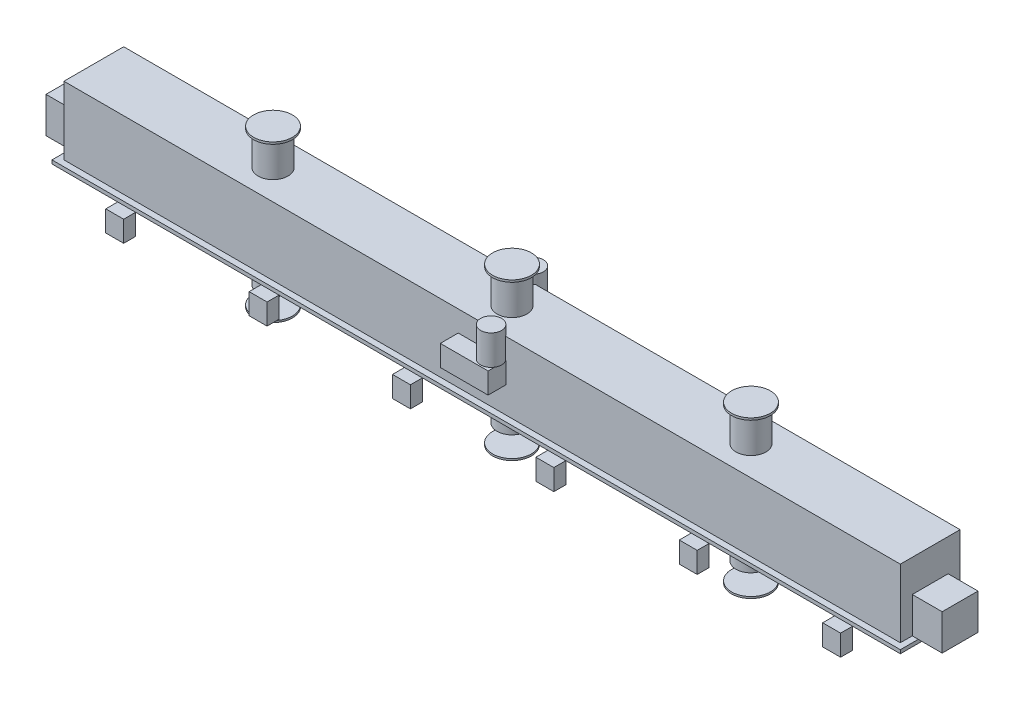
from build123d import *

# Parameters (mm, degrees)
SKETCH1_W               = 14000
SKETCH1_H               = 1000
BOSS_EXTRUDE1_DEPTH     = 500
BOSS_EXTRUDE2_START     = -500
SKETCH2_R               = 250
BOSS_EXTRUDE2_DEPTH     = 350
BOSS_EXTRUDE2_2_DEPTH   = 350
BOSS_EXTRUDE2_3_DEPTH   = 350
BOSS_EXTRUDE3_START     = -820
SKETCH3_R               = 325
BOSS_EXTRUDE3_DEPTH     = 30
BOSS_EXTRUDE3_2_DEPTH   = 30
BOSS_EXTRUDE3_3_DEPTH   = 30
SKETCH4_W               = 14200
SKETCH4_H               = 1200
BOSS_EXTRUDE4_DEPTH     = 60
BOSS_EXTRUDE5_START     = 60
SKETCH5_W               = 14000
SKETCH5_H               = 1000
BOSS_EXTRUDE5_DEPTH     = 1140
BOSS_EXTRUDE6_START     = 1200
SKETCH6_R               = 250
BOSS_EXTRUDE6_DEPTH     = 600
BOSS_EXTRUDE7_START     = 1765
SKETCH7_R               = 325
BOSS_EXTRUDE7_DEPTH     = 35
BOSS_EXTRUDE8_START     = 60
SKETCH8_W               = 500
SKETCH8_H               = 600
BOSS_EXTRUDE8_DEPTH     = 600
BOSS_EXTRUDE9_START     = 500
SKETCH9_W               = 800
SKETCH9_H               = 1600
BOSS_EXTRUDE9_DEPTH     = 350
BOSS_EXTRUDE10_START    = 850
SKETCH10_R              = 175
BOSS_EXTRUDE10_DEPTH    = 500
BOSS_EXTRUDE11_START    = -500
SKETCH11_W              = 300
SKETCH11_H              = 200
BOSS_EXTRUDE11_DEPTH    = 350
BOSS_EXTRUDE11_2_DEPTH  = 350
BOSS_EXTRUDE11_3_DEPTH  = 350
BOSS_EXTRUDE11_4_DEPTH  = 350
BOSS_EXTRUDE11_5_DEPTH  = 350
BOSS_EXTRUDE11_6_DEPTH  = 350
BOSS_EXTRUDE11_7_DEPTH  = 350
BOSS_EXTRUDE11_8_DEPTH  = 350
BOSS_EXTRUDE11_9_DEPTH  = 350
BOSS_EXTRUDE11_10_DEPTH = 350
BOSS_EXTRUDE11_11_DEPTH = 350
BOSS_EXTRUDE11_12_DEPTH = 350


with BuildPart() as part:
    # Sketch1 → Boss-Extrude1 (new body)
    with BuildSketch(Plane(origin=(0, 0, 0), x_dir=(1, 0, 0), z_dir=(0, 1, 0))):
        Rectangle(SKETCH1_W, SKETCH1_H)
    extrude(amount=BOSS_EXTRUDE1_DEPTH)

    # Sketch4 → Boss-Extrude4 (add)
    with BuildSketch(Plane(origin=(0, 0, 0), x_dir=(1, 0, 0), z_dir=(0, 1, 0))):
        Rectangle(SKETCH4_W, SKETCH4_H)
    extrude(amount=BOSS_EXTRUDE4_DEPTH)

    # Sketch5 → Boss-Extrude5 (add)
    with BuildSketch(Plane(origin=(0, 0, 0), x_dir=(1, 0, 0), z_dir=(0, 1, 0)).offset(BOSS_EXTRUDE5_START)):
        Rectangle(SKETCH5_W, SKETCH5_H)
    extrude(amount=BOSS_EXTRUDE5_DEPTH)

    # Sketch6 → Boss-Extrude6 (add)
    with BuildSketch(Plane(origin=(0, 0, 0), x_dir=(1, 0, 0), z_dir=(0, 1, 0)).offset(BOSS_EXTRUDE6_START)):
        with Locations(Location((-4000, 0, 0), (0, 0, 270))):
            Circle(SKETCH6_R)
        with Locations(Location((0, 0, 0), (0, 0, 270))):
            Circle(SKETCH6_R)
        with Locations(Location((4000, 0, 0), (0, 0, 270))):
            Circle(SKETCH6_R)
    extrude(amount=BOSS_EXTRUDE6_DEPTH)

    # Sketch7 → Boss-Extrude7 (add)
    with BuildSketch(Plane(origin=(0, 0, 0), x_dir=(1, 0, 0), z_dir=(0, 1, 0)).offset(BOSS_EXTRUDE7_START)):
        with Locations(Location((-4000, 0, 0), (0, 0, 270))):
            Circle(SKETCH7_R)
        with Locations(Location((0, 0, 0), (0, 0, 270))):
            Circle(SKETCH7_R)
        with Locations(Location((4000, 0, 0), (0, 0, 270))):
            Circle(SKETCH7_R)
    extrude(amount=BOSS_EXTRUDE7_DEPTH)

    # Sketch8 → Boss-Extrude8 (add)
    with BuildSketch(Plane(origin=(0, 0, 0), x_dir=(1, 0, 0), z_dir=(0, 1, 0)).offset(BOSS_EXTRUDE8_START)):
        with Locations((-7250, 0)):
            Rectangle(SKETCH8_W, SKETCH8_H)
        with Locations((7250, 0)):
            Rectangle(SKETCH8_W, SKETCH8_H)
    extrude(amount=BOSS_EXTRUDE8_DEPTH)

    # Sketch9 → Boss-Extrude9 (add)
    with BuildSketch(Plane(origin=(0, 0, 0), x_dir=(1, 0, 0), z_dir=(0, 1, 0)).offset(BOSS_EXTRUDE9_START)):
        Rectangle(SKETCH9_W, SKETCH9_H)
    extrude(amount=BOSS_EXTRUDE9_DEPTH)

    # Sketch10 → Boss-Extrude10 (add)
    with BuildSketch(Plane(origin=(0, 0, 0), x_dir=(1, 0, 0), z_dir=(0, 1, 0)).offset(BOSS_EXTRUDE10_START)):
        with Locations(Location((-250, 600, 0), (0, 0, 148.997280866))):
            Circle(SKETCH10_R)
        with Locations(Location((250, -600, 0), (0, 0, 34.849904579))):
            Circle(SKETCH10_R)
    extrude(amount=BOSS_EXTRUDE10_DEPTH)


with BuildPart() as body_2:
    # Sketch2 → Boss-Extrude2 (new body)
    with BuildSketch(Plane(origin=(0, 0, 0), x_dir=(1, 0, 0), z_dir=(0, 1, 0)).offset(BOSS_EXTRUDE2_START)):
        with Locations(Location((-4000, 0, 0), (0, 0, 270))):
            Circle(SKETCH2_R)
    extrude(amount=BOSS_EXTRUDE2_DEPTH)


with BuildPart() as body_3:
    # Sketch2 → Boss-Extrude2 2 (new body)
    with BuildSketch(Plane(origin=(0, 0, 0), x_dir=(1, 0, 0), z_dir=(0, 1, 0)).offset(BOSS_EXTRUDE2_START)):
        with Locations(Location((0, 0, 0), (0, 0, 270))):
            Circle(SKETCH2_R)
    extrude(amount=BOSS_EXTRUDE2_2_DEPTH)


with BuildPart() as body_4:
    # Sketch2 → Boss-Extrude2 3 (new body)
    with BuildSketch(Plane(origin=(0, 0, 0), x_dir=(1, 0, 0), z_dir=(0, 1, 0)).offset(BOSS_EXTRUDE2_START)):
        with Locations(Location((4000, 0, 0), (0, 0, 270))):
            Circle(SKETCH2_R)
    extrude(amount=BOSS_EXTRUDE2_3_DEPTH)


with BuildPart() as body_5:
    # Sketch3 → Boss-Extrude3 (new body)
    with BuildSketch(Plane(origin=(0, 0, 0), x_dir=(1, 0, 0), z_dir=(0, 1, 0)).offset(BOSS_EXTRUDE3_START)):
        with Locations(Location((-4000, 0, 0), (0, 0, 270))):
            Circle(SKETCH3_R)
    extrude(amount=BOSS_EXTRUDE3_DEPTH)


with BuildPart() as body_6:
    # Sketch3 → Boss-Extrude3 2 (new body)
    with BuildSketch(Plane(origin=(0, 0, 0), x_dir=(1, 0, 0), z_dir=(0, 1, 0)).offset(BOSS_EXTRUDE3_START)):
        with Locations(Location((0, 0, 0), (0, 0, 270))):
            Circle(SKETCH3_R)
    extrude(amount=BOSS_EXTRUDE3_2_DEPTH)


with BuildPart() as body_7:
    # Sketch3 → Boss-Extrude3 3 (new body)
    with BuildSketch(Plane(origin=(0, 0, 0), x_dir=(1, 0, 0), z_dir=(0, 1, 0)).offset(BOSS_EXTRUDE3_START)):
        with Locations(Location((4000, 0, 0), (0, 0, 270))):
            Circle(SKETCH3_R)
    extrude(amount=BOSS_EXTRUDE3_3_DEPTH)


with BuildPart() as body_8:
    # Sketch11 → Boss-Extrude11 (new body)
    with BuildSketch(Plane(origin=(0, 0, 0), x_dir=(1, 0, 0), z_dir=(0, 1, 0)).offset(BOSS_EXTRUDE11_START)):
        with Locations((-6000, -550)):
            Rectangle(SKETCH11_W, SKETCH11_H)
    extrude(amount=BOSS_EXTRUDE11_DEPTH)


with BuildPart() as body_9:
    # Sketch11 → Boss-Extrude11 2 (new body)
    with BuildSketch(Plane(origin=(0, 0, 0), x_dir=(1, 0, 0), z_dir=(0, 1, 0)).offset(BOSS_EXTRUDE11_START)):
        with Locations((-6000, 550)):
            Rectangle(SKETCH11_W, SKETCH11_H)
    extrude(amount=BOSS_EXTRUDE11_2_DEPTH)


with BuildPart() as body_10:
    # Sketch11 → Boss-Extrude11 3 (new body)
    with BuildSketch(Plane(origin=(0, 0, 0), x_dir=(1, 0, 0), z_dir=(0, 1, 0)).offset(BOSS_EXTRUDE11_START)):
        with Locations((-3600, -550)):
            Rectangle(SKETCH11_W, SKETCH11_H)
    extrude(amount=BOSS_EXTRUDE11_3_DEPTH)


with BuildPart() as body_11:
    # Sketch11 → Boss-Extrude11 4 (new body)
    with BuildSketch(Plane(origin=(0, 0, 0), x_dir=(1, 0, 0), z_dir=(0, 1, 0)).offset(BOSS_EXTRUDE11_START)):
        with Locations((-3600, 550)):
            Rectangle(SKETCH11_W, SKETCH11_H)
    extrude(amount=BOSS_EXTRUDE11_4_DEPTH)


with BuildPart() as body_12:
    # Sketch11 → Boss-Extrude11 5 (new body)
    with BuildSketch(Plane(origin=(0, 0, 0), x_dir=(1, 0, 0), z_dir=(0, 1, 0)).offset(BOSS_EXTRUDE11_START)):
        with Locations((-1200, -550)):
            Rectangle(SKETCH11_W, SKETCH11_H)
    extrude(amount=BOSS_EXTRUDE11_5_DEPTH)


with BuildPart() as body_13:
    # Sketch11 → Boss-Extrude11 6 (new body)
    with BuildSketch(Plane(origin=(0, 0, 0), x_dir=(1, 0, 0), z_dir=(0, 1, 0)).offset(BOSS_EXTRUDE11_START)):
        with Locations((-1200, 550)):
            Rectangle(SKETCH11_W, SKETCH11_H)
    extrude(amount=BOSS_EXTRUDE11_6_DEPTH)


with BuildPart() as body_14:
    # Sketch11 → Boss-Extrude11 7 (new body)
    with BuildSketch(Plane(origin=(0, 0, 0), x_dir=(1, 0, 0), z_dir=(0, 1, 0)).offset(BOSS_EXTRUDE11_START)):
        with Locations((1200, -550)):
            Rectangle(SKETCH11_W, SKETCH11_H)
    extrude(amount=BOSS_EXTRUDE11_7_DEPTH)


with BuildPart() as body_15:
    # Sketch11 → Boss-Extrude11 8 (new body)
    with BuildSketch(Plane(origin=(0, 0, 0), x_dir=(1, 0, 0), z_dir=(0, 1, 0)).offset(BOSS_EXTRUDE11_START)):
        with Locations((1200, 550)):
            Rectangle(SKETCH11_W, SKETCH11_H)
    extrude(amount=BOSS_EXTRUDE11_8_DEPTH)


with BuildPart() as body_16:
    # Sketch11 → Boss-Extrude11 9 (new body)
    with BuildSketch(Plane(origin=(0, 0, 0), x_dir=(1, 0, 0), z_dir=(0, 1, 0)).offset(BOSS_EXTRUDE11_START)):
        with Locations((3600, -550)):
            Rectangle(SKETCH11_W, SKETCH11_H)
    extrude(amount=BOSS_EXTRUDE11_9_DEPTH)


with BuildPart() as body_17:
    # Sketch11 → Boss-Extrude11 10 (new body)
    with BuildSketch(Plane(origin=(0, 0, 0), x_dir=(1, 0, 0), z_dir=(0, 1, 0)).offset(BOSS_EXTRUDE11_START)):
        with Locations((3600, 550)):
            Rectangle(SKETCH11_W, SKETCH11_H)
    extrude(amount=BOSS_EXTRUDE11_10_DEPTH)


with BuildPart() as body_18:
    # Sketch11 → Boss-Extrude11 11 (new body)
    with BuildSketch(Plane(origin=(0, 0, 0), x_dir=(1, 0, 0), z_dir=(0, 1, 0)).offset(BOSS_EXTRUDE11_START)):
        with Locations((6000, -550)):
            Rectangle(SKETCH11_W, SKETCH11_H)
    extrude(amount=BOSS_EXTRUDE11_11_DEPTH)


with BuildPart() as body_19:
    # Sketch11 → Boss-Extrude11 12 (new body)
    with BuildSketch(Plane(origin=(0, 0, 0), x_dir=(1, 0, 0), z_dir=(0, 1, 0)).offset(BOSS_EXTRUDE11_START)):
        with Locations((6000, 550)):
            Rectangle(SKETCH11_W, SKETCH11_H)
    extrude(amount=BOSS_EXTRUDE11_12_DEPTH)


solid = Compound([part.part, body_2.part, body_3.part, body_4.part, body_5.part, body_6.part, body_7.part, body_8.part, body_9.part, body_10.part, body_11.part, body_12.part, body_13.part, body_14.part, body_15.part, body_16.part, body_17.part, body_18.part, body_19.part])
